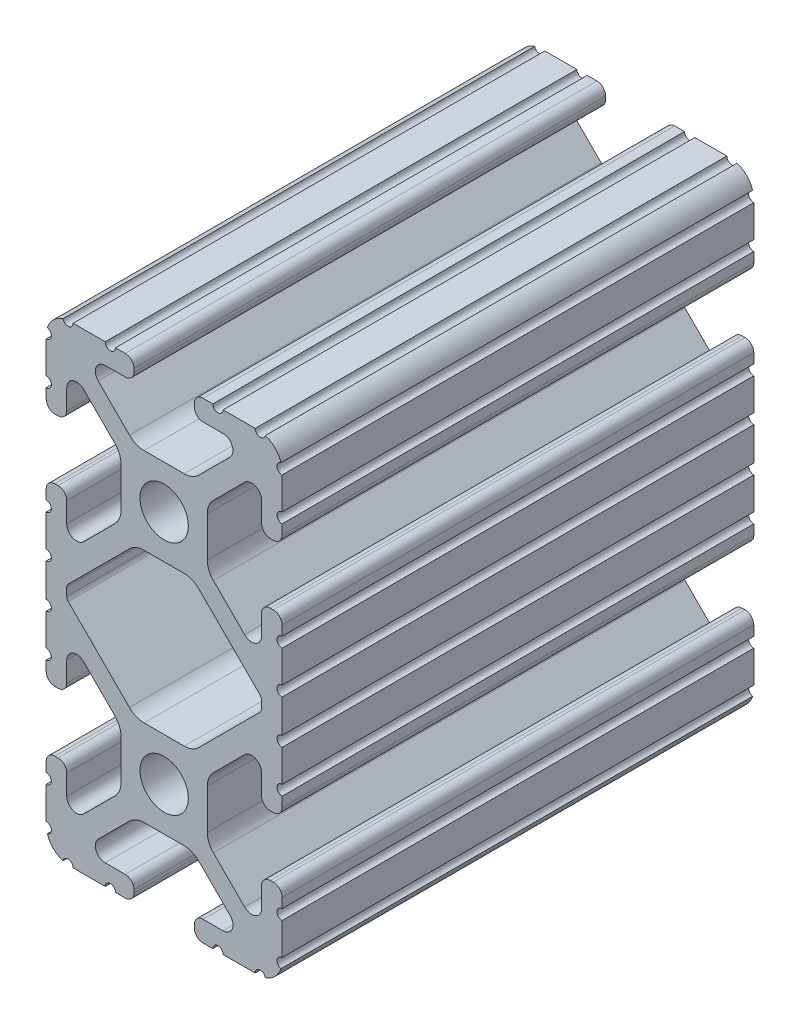
from build123d import *

# Parameters (mm, degrees)
BOSS_EXTRUDE1_DEPTH     = 25.4
CUT_EXTRUDE1_DEPTH      = 39.1
CUT_EXTRUDE1_DEPTH_BACK = 39.1
SKETCH5_R               = 0.55245
BOSS_EXTRUDE2_DEPTH     = 25.4
CUT_EXTRUDE2_DEPTH      = 39.1
CUT_EXTRUDE2_DEPTH_BACK = 39.1


with BuildPart() as part:
    # Sketch4 → Boss-Extrude1 (new, symmetric)
    with BuildSketch(Plane.XY):
        with BuildLine():
            Line((4.190365, -25.4), (10.11729625, -25.4))
            ThreePointArc((10.11729625, -25.4), (11.943543585, -24.643543585), (12.7, -22.81729625))
            Line((12.7, -22.81729625), (12.7, -16.890365))
            ThreePointArc((12.7, -16.890365), (12.42492494, -16.22627506), (11.760835, -15.9512))
            Line((11.760835, -15.9512), (11.429365, -15.9512))
            ThreePointArc((11.429365, -15.9512), (10.76527506, -16.22627506), (10.4902, -16.890365))
            Line((10.4902, -16.890365), (10.4902, -19.048478019))
            ThreePointArc((10.4902, -19.048478019), (9.830707141, -20.035478831), (8.666460301, -19.803895736))
            Line((8.666460301, -19.803895736), (5.299899128, -16.437334563))
            ThreePointArc((5.299899128, -16.437334563), (4.817571085, -15.715479634), (4.6482, -14.86399369))
            Line((4.6482, -14.86399369), (4.6482, -12.7))
            Line((4.6482, -12.7), (2.6035, -12.7))
            ThreePointArc((2.6035, -12.7), (1.840952505, -14.540952505), (0, -15.3035))
            Line((0, -15.3035), (0, -17.3482))
            Line((0, -17.3482), (2.16399369, -17.3482))
            ThreePointArc((2.16399369, -17.3482), (3.015479634, -17.517571085), (3.737334563, -17.999899128))
            Line((3.737334563, -17.999899128), (7.103895736, -21.366460301))
            ThreePointArc((7.103895736, -21.366460301), (7.335478831, -22.530707141), (6.348478019, -23.1902))
            Line((6.348478019, -23.1902), (4.190365, -23.1902))
            ThreePointArc((4.190365, -23.1902), (3.52627506, -23.46527506), (3.2512, -24.129365))
            Line((3.2512, -24.129365), (3.2512, -24.460835))
            ThreePointArc((3.2512, -24.460835), (3.52627506, -25.12492494), (4.190365, -25.4))
        make_face()
    extrude(amount=BOSS_EXTRUDE1_DEPTH, both=True)

    # Sketch5 → Cut-Extrude1 (cut, two sides: drawn at the far end of the back side and taken through both)
    with BuildSketch(Plane.XY.offset(-CUT_EXTRUDE1_DEPTH_BACK)):
        with Locations((10.356153152, -25.4)):
            Circle(SKETCH5_R)
        with Locations((5.796028019, -25.4)):
            Circle(SKETCH5_R)
        with Locations((12.7, -23.056153152)):
            Circle(SKETCH5_R)
        with Locations((12.7, -18.496028019)):
            Circle(SKETCH5_R)
    extrude(amount=CUT_EXTRUDE1_DEPTH + CUT_EXTRUDE1_DEPTH_BACK, mode=Mode.SUBTRACT)

    # Mirror1: part across plane


with BuildPart() as part_1:
    add(part.part)
    add(part.part.mirror(Plane(origin=(4.6482, -12.7, 25.4), x_dir=(0, 0, 1), z_dir=(0, -1, 0))))

    # Sketch6 → Boss-Extrude2 (add, symmetric)
    with BuildSketch(Plane.XY):
        with BuildLine():
            Line((12.7, -1.791396848), (12.7, 0))
            Line((12.7, 0), (9.803703152, 0))
            Line((9.803703152, 0), (9.803703152, -2.343846848))
            Line((9.803703152, -2.343846848), (12.14755, -2.343846848))
            ThreePointArc((12.14755, -2.343846848), (12.309358859, -1.953205706), (12.7, -1.791396848))
        make_face()
    extrude(amount=BOSS_EXTRUDE2_DEPTH, both=True)

    # Sketch7 → Cut-Extrude2 (cut, two sides: drawn at the far end of the back side and taken through both)
    with BuildSketch(Plane.XY.offset(-CUT_EXTRUDE2_DEPTH_BACK)):
        with BuildLine():
            Line((5.420615149, -5.716820286), (10.328391141, -0.809044294))
            ThreePointArc((10.328391141, -0.809044294), (10.448147248, -0.629816615), (10.4902, -0.418403152))
            Line((10.4902, -0.418403152), (10.4902, 0))
            Line((10.4902, 0), (0, 0))
            Line((0, 0), (5.420615149, -5.716820286))
        make_face()
    extrude(amount=CUT_EXTRUDE2_DEPTH + CUT_EXTRUDE2_DEPTH_BACK, mode=Mode.SUBTRACT)

    # Mirror2: part across plane


with BuildPart() as part_2:
    add(part_1.part)
    add(part_1.part.mirror(Plane.ZX))

    # Mirror3: part across plane


with BuildPart() as part_3:
    add(part_2.part)
    add(part_2.part.mirror(Plane(origin=(0, 0, 0), x_dir=(0, 0, 1), z_dir=(1, 0, 0))))


solid = part_3.part
